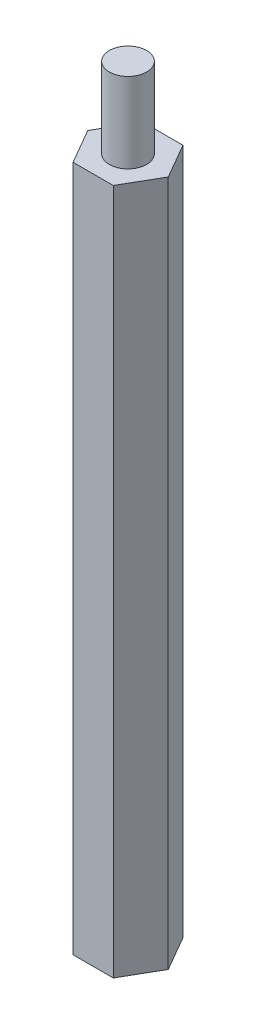
from build123d import *

# Parameters (mm, degrees)
BOSS_EXTRUDE1_DEPTH = 50.038
SKETCH2_R           = 1.3589
BOSS_EXTRUDE2_DEPTH = 5.842
SKETCH3_R           = 1.3589
CUT_EXTRUDE1_DEPTH  = 8.382


with BuildPart() as part:
    # Sketch1 → Boss-Extrude1 (new body)
    with BuildSketch(Plane(origin=(0, 0, 0), x_dir=(1, 0, 0), z_dir=(0, 1, 0))):
        Polygon((2.932939367, 0), (1.466469684, 2.54), (-1.466469684, 2.54), (-2.932939367, 0), (-1.466469684, -2.54), (1.466469684, -2.54), align=None)
    extrude(amount=BOSS_EXTRUDE1_DEPTH)

    # Sketch2 → Boss-Extrude2 (add)
    with BuildSketch(Plane(origin=(0, 50.038, 0), x_dir=(1, 0, 0), z_dir=(0, 1, 0))):
        with Locations(Location((0, 0, 0), (0, 0, 270))):
            Circle(SKETCH2_R)
    extrude(amount=BOSS_EXTRUDE2_DEPTH)

    # Sketch3 → Cut-Extrude1 (cut)
    with BuildSketch(Plane(origin=(0, 0, 0), x_dir=(-1, 0, 0), z_dir=(0, -1, 0))):
        with Locations(Location((0, 0, 0), (0, 0, 270))):
            Circle(SKETCH3_R)
    extrude(amount=-CUT_EXTRUDE1_DEPTH, mode=Mode.SUBTRACT)


solid = part.part
